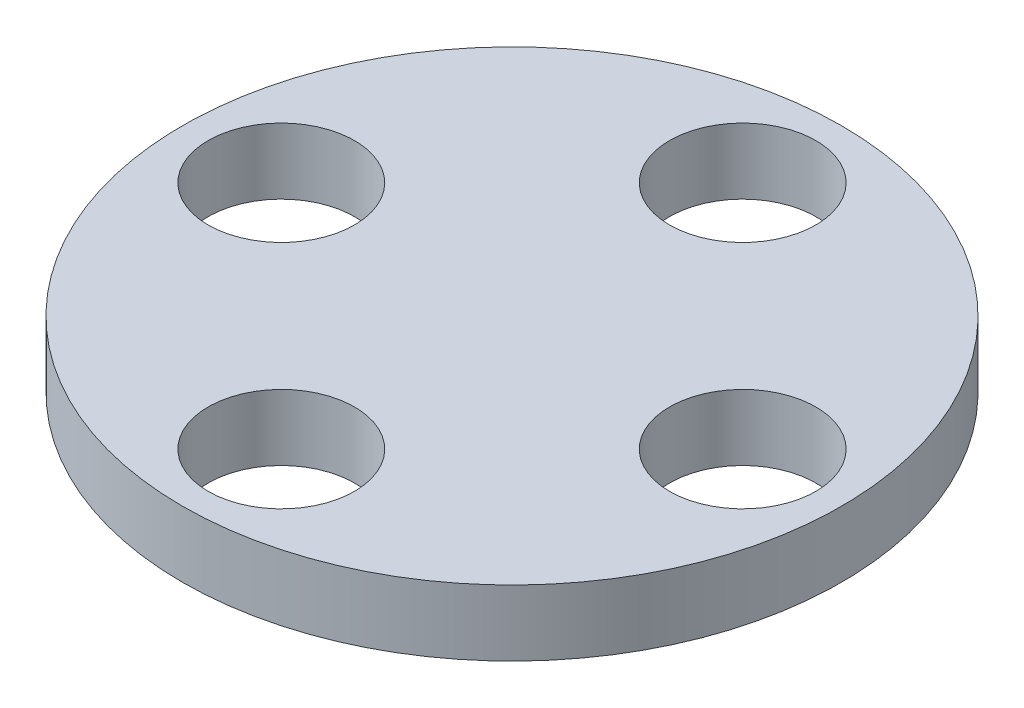
from build123d import *

# Parameters (mm, degrees)
SKETCH2_R           = 12.7
SKETCH2_R_2         = 2.8194
BOSS_EXTRUDE1_DEPTH = 2.54


with BuildPart() as part:
    # Sketch2 → Boss-Extrude1 (new body)
    with BuildSketch(Plane(origin=(0, 0, 0), x_dir=(1, 0, 0), z_dir=(0, 1, 0))):
        with Locations(Location((0, -0.76910059, 0), (0, 0, 270))):
            Circle(SKETCH2_R)
        with Locations(Location((0, 8.12089941, 0), (0, 0, 270))):
            Circle(SKETCH2_R_2, mode=Mode.SUBTRACT)
        with Locations(Location((8.89, -0.76910059, 0), (0, 0, 270))):
            Circle(SKETCH2_R_2, mode=Mode.SUBTRACT)
        with Locations(Location((0, -9.65910059, 0), (0, 0, 270))):
            Circle(SKETCH2_R_2, mode=Mode.SUBTRACT)
        with Locations(Location((-8.89, -0.76910059, 0), (0, 0, 270))):
            Circle(SKETCH2_R_2, mode=Mode.SUBTRACT)
    extrude(amount=BOSS_EXTRUDE1_DEPTH)


solid = part.part
